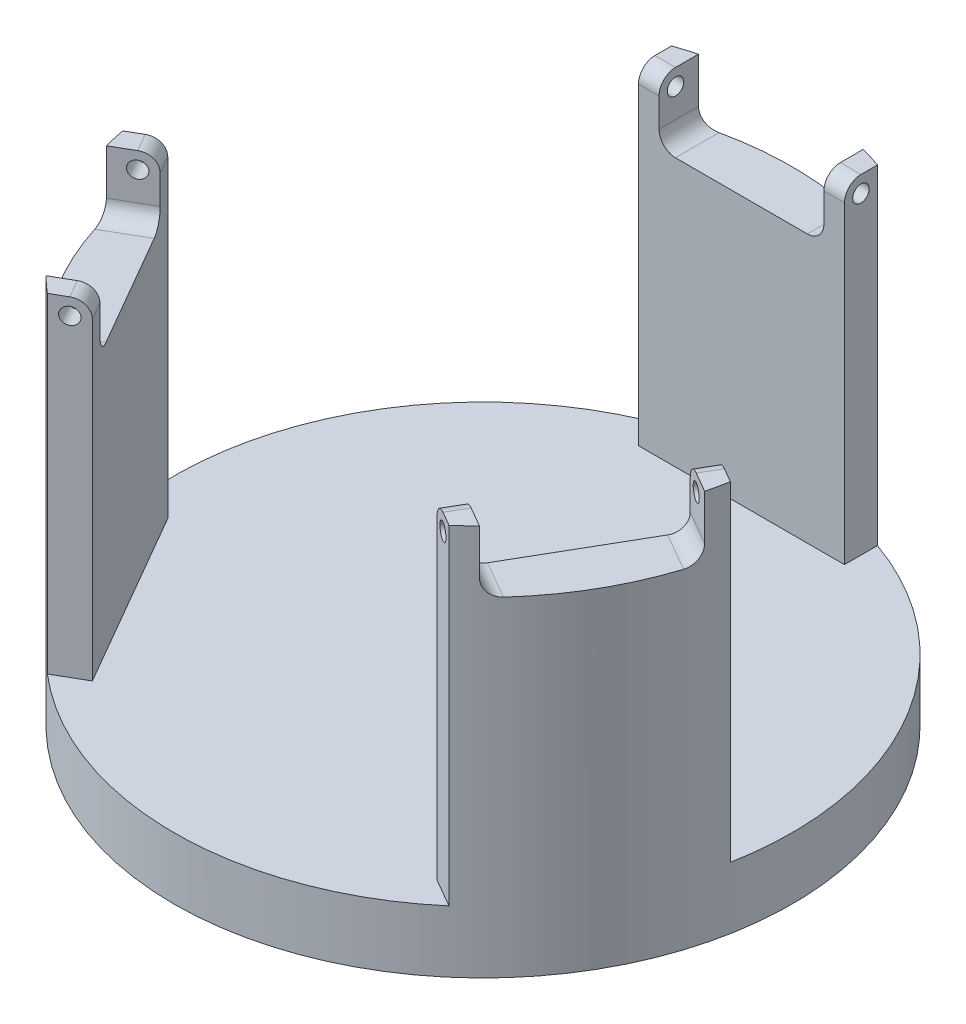
from build123d import *

# Parameters (mm, degrees)
SKETCH1_R                = 75
BOSS_EXTRUDE1_DEPTH      = 15
BOSS_EXTRUDE2_DEPTH      = 80
CUT_EXTRUDE1_START       = -15
CUT_EXTRUDE1_DEPTH       = 15
F_4_0_MM_DOWEL_HOLES1_D  = 4
FILLET1_R                = 4
FILLET2_R                = 4
CIRPATTERN1_COUNT        = 3
FILLET1_OF_CIRPATTERN1_R = 4
FILLET2_OF_CIRPATTERN1_R = 4


with BuildPart() as part:
    # Sketch1 → Boss-Extrude1 (new body)
    with BuildSketch(Plane(origin=(0, 0, 0), x_dir=(1, 0, 0), z_dir=(0, 1, 0))):
        with Locations(Location((0, 0, 0), (0, 0, 270))):
            Circle(SKETCH1_R)
    extrude(amount=BOSS_EXTRUDE1_DEPTH)

    # Sketch2 → Boss-Extrude2 (add)
    with BuildSketch(Plane(origin=(0, 15, 0), x_dir=(1, 0, 0), z_dir=(0, 1, 0))):
        with BuildLine():
            Line((-25, 70.710678119), (-25, 62.710678119))
            Line((-25, 62.710678119), (25, 62.710678119))
            Line((25, 62.710678119), (25, 70.710678119))
            ThreePointArc((25, 70.710678119), (0, 75), (-25, 70.710678119))
        make_face()
    boss_extrude2 = extrude(amount=BOSS_EXTRUDE2_DEPTH)

    # Sketch3 → Cut-Extrude1 (cut)
    with BuildSketch(Plane(origin=(0, 95, 0), x_dir=(1, 0, 0), z_dir=(0, 1, 0)).offset(CUT_EXTRUDE1_START)):
        with BuildLine():
            Line((-20, 72.284161474), (-20, 62.710678119))
            Line((-20, 62.710678119), (20, 62.710678119))
            Line((20, 62.710678119), (20, 72.284161474))
            ThreePointArc((20, 72.284161474), (0, 75), (-20, 72.284161474))
        make_face()
    cut_extrude1 = extrude(amount=CUT_EXTRUDE1_DEPTH, mode=Mode.SUBTRACT)

    # Ø4.0 mm Dowel Holes1 (through all)
    with Locations(Plane(origin=(25, 0, 0), x_dir=(0, 0, -1), z_dir=(1, 0, 0))):
        with Locations((66.710678119, 91)):
            f_4_0_mm_dowel_holes1 = Hole(F_4_0_MM_DOWEL_HOLES1_D / 2)

    # Fillet1
    fillet1_edges = [part.edges().sort_by_distance(p)[0] for p in [
        (22.5, 95, -62.710678119),
        (-22.5, 95, -62.710678119),
    ]]
    fillet(fillet1_edges, radius=FILLET1_R)

    # Fillet2
    fillet2_edges = [part.edges().sort_by_distance(p)[0] for p in [
        (20, 80, -67.497419796),
        (-20, 80, -67.497419796),
    ]]
    fillet(fillet2_edges, radius=FILLET2_R)

    # CirPattern1: Boss-Extrude2, Cut-Extrude1, Ø4.0 mm Dowel Holes1 ×3 about axis
    cirpattern1_axis = Axis((0, 0, 0), (0, 1, 0))
    add([boss_extrude2.rotate(cirpattern1_axis, i * 360 / CIRPATTERN1_COUNT) for i in range(1, CIRPATTERN1_COUNT)])
    add([cut_extrude1.rotate(cirpattern1_axis, i * 360 / CIRPATTERN1_COUNT) for i in range(1, CIRPATTERN1_COUNT)], mode=Mode.SUBTRACT)
    add([f_4_0_mm_dowel_holes1.rotate(cirpattern1_axis, i * 360 / CIRPATTERN1_COUNT) for i in range(1, CIRPATTERN1_COUNT)], mode=Mode.SUBTRACT)

    # Fillet1 of CirPattern1
    fillet1_of_cirpattern1_edges = [part.edges().sort_by_distance(p)[0] for p in [
        (-65.559040339, 95, 11.869767474),
        (-43.059040339, 95, 50.840910644),
        (43.059040339, 95, 50.840910644),
        (65.559040339, 95, 11.869767474),
    ]]
    fillet(fillet1_of_cirpattern1_edges, radius=FILLET1_OF_CIRPATTERN1_R)

    # Fillet2 of CirPattern1
    fillet2_of_cirpattern1_edges = [part.edges().sort_by_distance(p)[0] for p in [
        (-68.454480234, 80, 16.428201822),
        (-48.454480234, 80, 51.069217974),
        (48.454480234, 80, 51.069217974),
        (68.454480234, 80, 16.428201822),
    ]]
    fillet(fillet2_of_cirpattern1_edges, radius=FILLET2_OF_CIRPATTERN1_R)


solid = part.part
